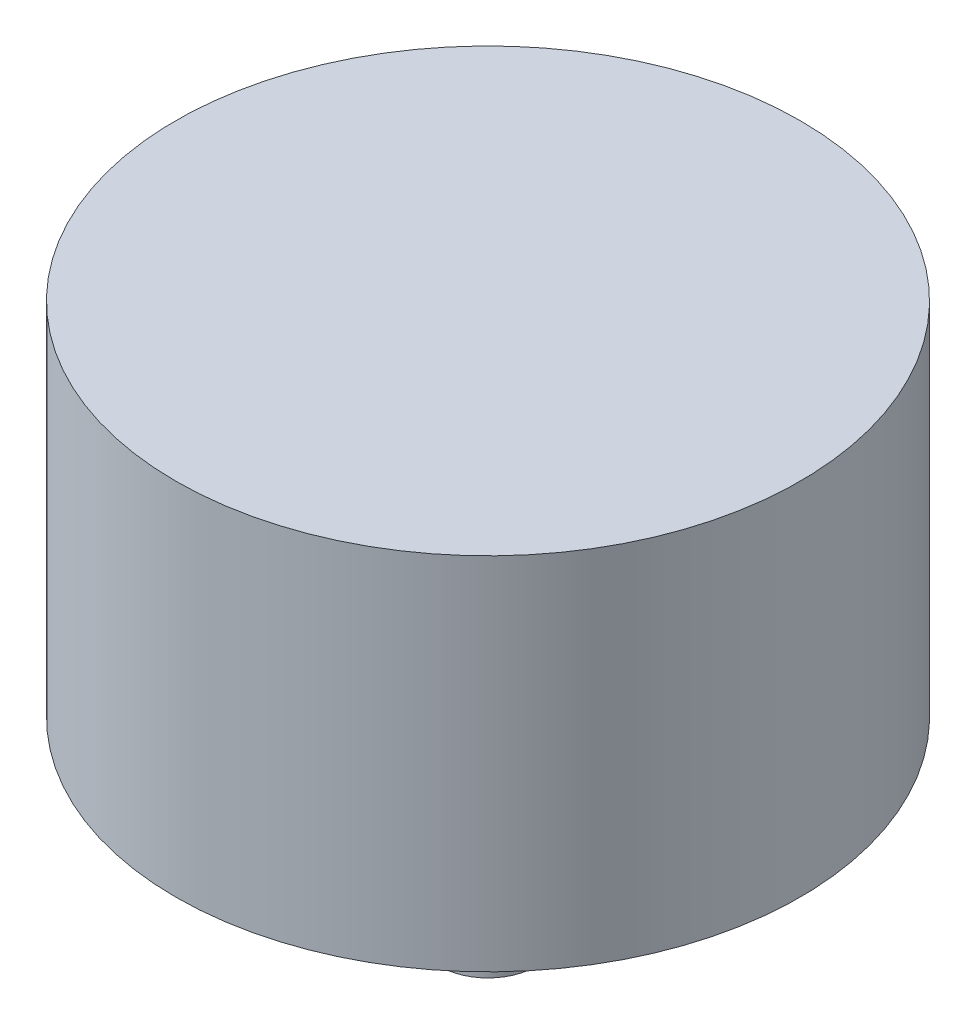
from build123d import *

# Parameters (mm, degrees)
SKETCH1_R           = 650
BOSS_EXTRUDE1_DEPTH = 750
SKETCH3_R           = 100
BOSS_EXTRUDE2_DEPTH = 400


with BuildPart() as part:
    # Sketch1 → Boss-Extrude1 (new body)
    with BuildSketch(Plane(origin=(0, 0, 0), x_dir=(1, 0, 0), z_dir=(0, 1, 0))):
        with Locations(Location((0, 0, 0), (0, 0, 270))):
            Circle(SKETCH1_R)
    extrude(amount=BOSS_EXTRUDE1_DEPTH)

    # Sketch3 → Boss-Extrude2 (add)
    with BuildSketch(Plane.XZ):
        with Locations(Location((0, 0, 0), (0, 0, 270))):
            Circle(SKETCH3_R)
    extrude(amount=BOSS_EXTRUDE2_DEPTH)


solid = part.part
